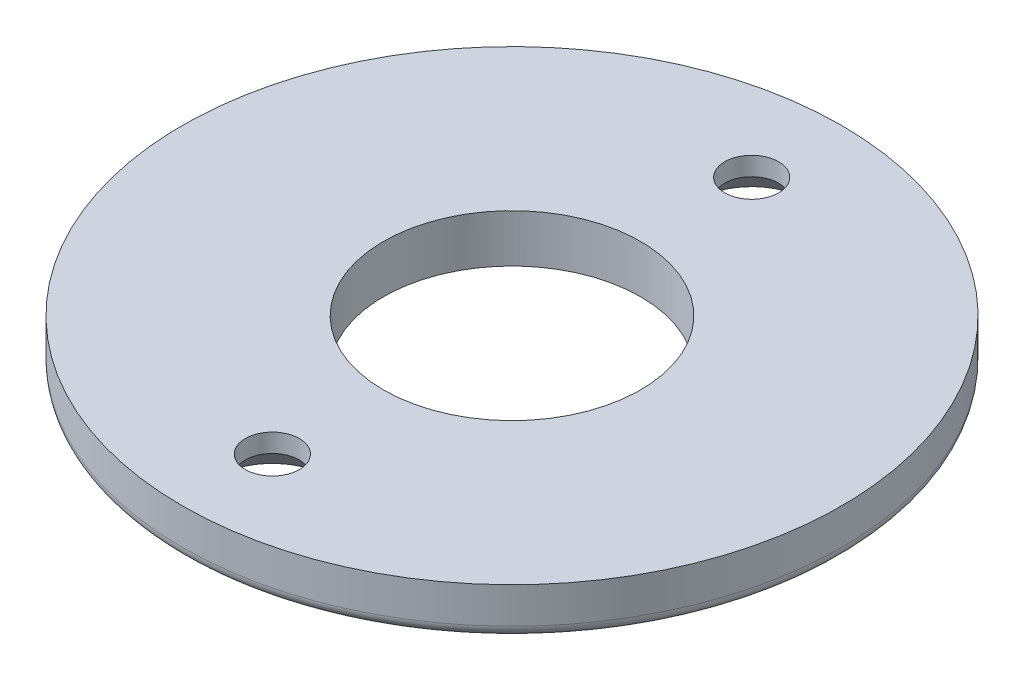
from build123d import *

# Parameters (mm, degrees)
CSK_SLOT_FOR_M4_COUNTERSUNK_FLAT_HEA_2_COUNT = 2
CSK_SLOT_FOR_M4_COUNTERSUNK_FLAT_HEA_2_PITCH = 40
FILLET1_R                                    = 2
FILLET2_R                                    = 1
SKETCH5_R                                    = 32.94079545
CUT_EXTRUDE2_DEPTH                           = 10
SKETCH6_R                                    = 10.732050808
CUT_EXTRUDE3_DEPTH                           = 10


with BuildPart() as part:
    # Sketch1 → Revolve1 (revolve)
    with BuildSketch(Plane.XY, mode=Mode.PRIVATE) as revolve1_sk:
        Polygon((-27.5, 0), (-27.5, 4), (-13, 4), (-13, 8), (-11, 8), (-11, 3), (0, 3), (0, 0), align=None)
    revolve(revolve1_sk.sketch.rotate(Axis((0, 0, 0), (0, -1, 0)), 270), axis=Axis((0, 0, 0), (0, -1, 0)))

    # Sketch3 → CSK SLOT for M4 Countersunk Flat Head Screw1 (revolve, cut)
    with BuildSketch(Plane(origin=(0, 0, 20), x_dir=(0, 0, -1), z_dir=(1, 0, 0))):
        Polygon((0, 0), (0, 4), (2.25, 4), (2.25, 2.45), (4.7, 0), align=None)
    csk_slot_for_m4_countersunk_flat_head_sc = revolve(axis=Axis((0, -6.35, 20), (0, 1, 0)), mode=Mode.SUBTRACT)

    # CSK SLOT for M4 Countersunk Flat Hea 2: CSK SLOT for M4 Countersunk Flat Head Screw1 ×2
    with Locations(*[(0, 0, -i * CSK_SLOT_FOR_M4_COUNTERSUNK_FLAT_HEA_2_PITCH) for i in range(1, CSK_SLOT_FOR_M4_COUNTERSUNK_FLAT_HEA_2_COUNT)]):
        add(csk_slot_for_m4_countersunk_flat_head_sc, mode=Mode.SUBTRACT)

    # Fillet1
    fillet1_edges = [part.edges().sort_by_distance(p)[0] for p in [
        (0, 3, -11),
    ]]
    fillet(fillet1_edges, radius=FILLET1_R)

    # Fillet2
    fillet2_edges = [part.edges().sort_by_distance(p)[0] for p in [
        (0, 0, -27.5),
    ]]
    fillet(fillet2_edges, radius=FILLET2_R)

    # Sketch5 → Cut-Extrude2 (cut)
    with BuildSketch(Plane(origin=(0, 4, 0), x_dir=(1, 0, 0), z_dir=(0, 1, 0))):
        Circle(SKETCH5_R)
    extrude(amount=CUT_EXTRUDE2_DEPTH, mode=Mode.SUBTRACT)

    # Sketch6 → Cut-Extrude3 (cut)
    with BuildSketch(Plane(origin=(0, 4, 0), x_dir=(1, 0, 0), z_dir=(0, 1, 0))):
        with Locations(Location((0, 0, 0), (0, 0, 270))):
            Circle(SKETCH6_R)
    extrude(amount=-CUT_EXTRUDE3_DEPTH, mode=Mode.SUBTRACT)


solid = part.part
